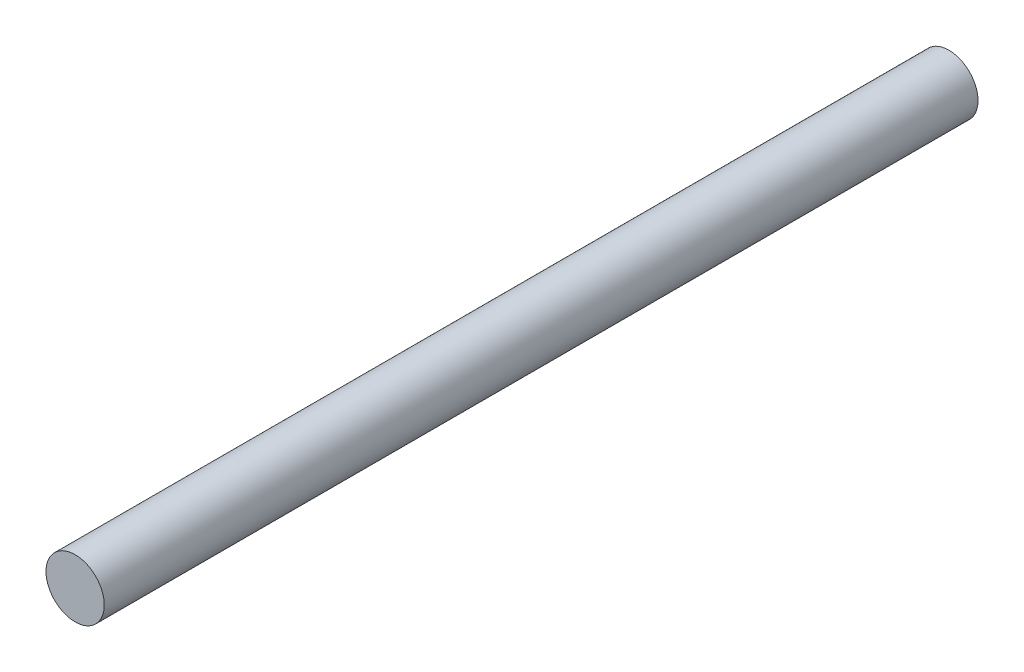
from build123d import *

# Parameters (mm, degrees)
SKETCH1_R           = 3
BOSS_EXTRUDE1_DEPTH = 90


with BuildPart() as part:
    # Sketch1 → Boss-Extrude1 (new body)
    with BuildSketch(Plane.XY):
        with Locations(Location((0, 0, 0), (0, 0, 180))):
            Circle(SKETCH1_R)
    extrude(amount=BOSS_EXTRUDE1_DEPTH)


solid = part.part
